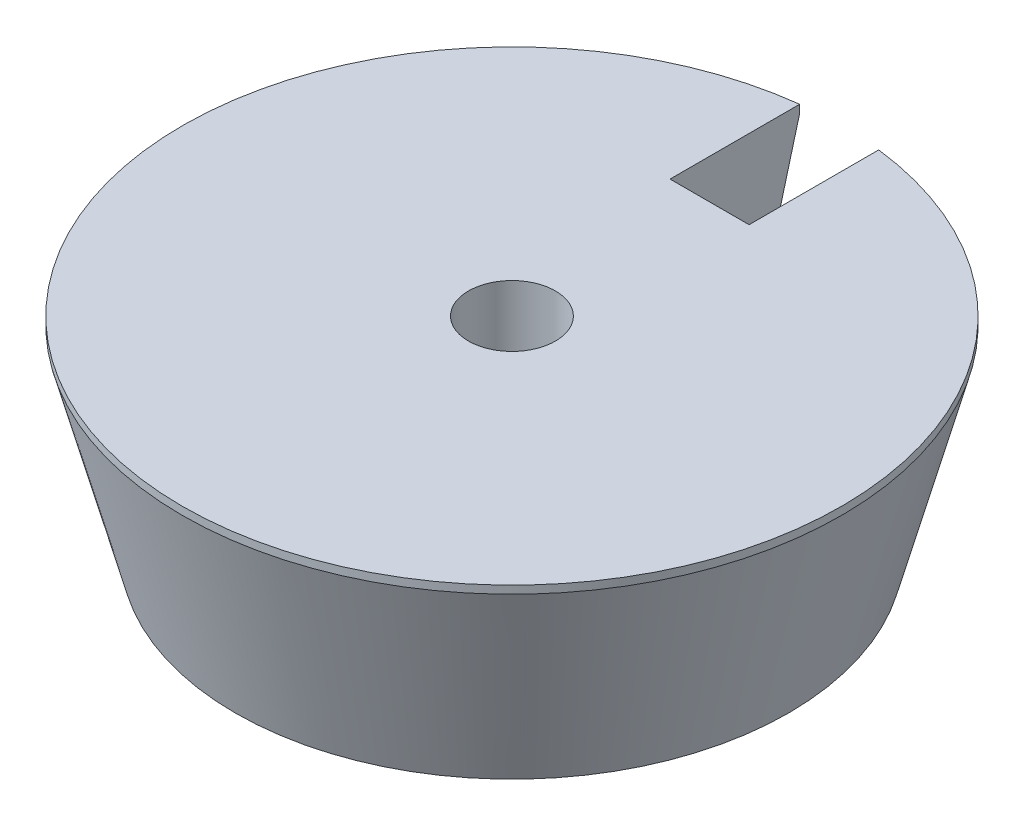
from build123d import *

# Parameters (mm, degrees)
SKETCH1_R                  = 35
EXTRUDE1_DEPTH             = 25
EXTRUDE1_DRAFT             = -15
SKETCH2_R                  = 8
EXTRUDE2_DEPTH             = 12
SKETCH3_W                  = 10
SKETCH3_H                  = 30
CUT_EXTRUDE1_DEPTH         = 70.617297676
EXTRUDE4_DEPTH             = 1
F_11_0_11_DIAMETER_HOLE1_D = 11


with BuildPart() as part:
    # Sketch1 → Extrude1 (with draft: the straight prism first)
    with BuildSketch(Plane(origin=(0, 0, 0), x_dir=(1, 0, 0), z_dir=(0, 1, 0))):
        Circle(SKETCH1_R)
    extrude(amount=EXTRUDE1_DEPTH)
    # Extrude1: the draft: its side faces are tilted about the plane it starts from
    extrude1_sides = [part.faces().sort_by_distance(p)[0] for p in [
        (-35, 12.5, 0),
    ]]
    draft(extrude1_sides, Plane(origin=(0, 0, 0), x_dir=(1, 0, 0), z_dir=(0, 1, 0)), EXTRUDE1_DRAFT)

    # Sketch2 → Extrude2 (add)
    with BuildSketch(Plane.XZ):
        with Locations(Location((0, 0, 0), (0, 0, 90))):
            Circle(SKETCH2_R)
    extrude(amount=EXTRUDE2_DEPTH)

    # Sketch3 → Cut-Extrude1 (cut, through all)
    with BuildSketch(Plane(origin=(0, 25, 0), x_dir=(1, 0, 0), z_dir=(0, 1, 0))):
        with Locations((0, 40)):
            Rectangle(SKETCH3_W, SKETCH3_H)
    extrude(amount=-CUT_EXTRUDE1_DEPTH, mode=Mode.SUBTRACT)

    # Sketch5 → Extrude4 (add)
    with BuildSketch(Plane(origin=(0, 25, 0), x_dir=(1, 0, 0), z_dir=(0, 1, 0))):
        with BuildLine():
            Line((-5, 25), (-5, 41.397875161))
            ThreePointArc((-5, 41.397875161), (0, -41.698729811), (5, 41.397875161))
            Line((5, 41.397875161), (5, 25))
            Line((5, 25), (-5, 25))
        make_face()
    extrude(amount=EXTRUDE4_DEPTH)

    # Ø11.0 (11) Diameter Hole1 (through all)
    with Locations(Plane(origin=(0, 26, 0), x_dir=(1, 0, 0), z_dir=(0, 1, 0))):
        with Locations((0, 0)):
            Hole(F_11_0_11_DIAMETER_HOLE1_D / 2)


solid = part.part
